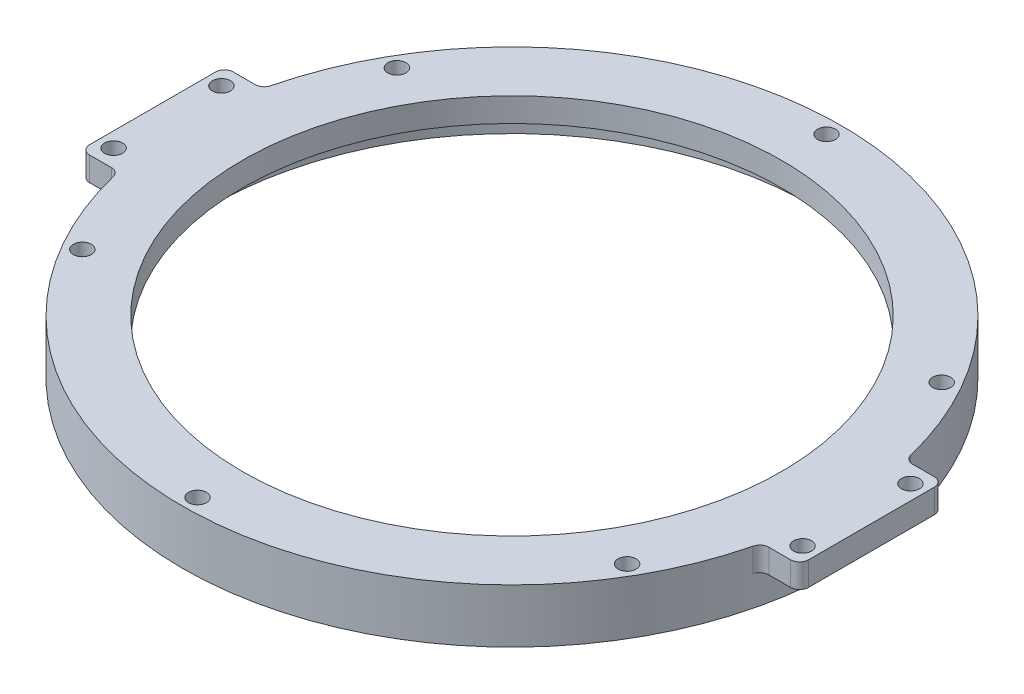
from build123d import *

# Parameters (mm, degrees)
SKETCH_1_R      = 1.5
SKETCH_1_R_2    = 45
EXTRUDE_1_DEPTH = 4
EXTRUDE_START   = -5
SKETCH_2_R      = 55
SKETCH_2_R_2    = 1.5
SKETCH_2_R_3    = 50
EXTRUDE_2_DEPTH = 5


with BuildPart() as part:
    # 草图1 → 凸台-拉伸1 (new body)
    with BuildSketch(Plane(origin=(0, 0, 0), x_dir=(1, 0, 0), z_dir=(0, 1, 0))):
        with BuildLine():
            ThreePointArc((-54.863466897, 12), (-53.938159008, 12.31940468), (-53.406914679, 13.14159292))
            ThreePointArc((-53.406914679, 13.14159292), (0, 55), (53.406914679, 13.14159292))
            ThreePointArc((53.406914679, 13.14159292), (53.938159008, 12.31940468), (54.863466897, 12))
            Line((54.863466897, 12), (58.5, 12))
            ThreePointArc((58.5, 12), (59.560660172, 11.560660172), (60, 10.5))
            Line((60, 10.5), (60, -10.5))
            ThreePointArc((60, -10.5), (59.560660172, -11.560660172), (58.5, -12))
            Line((58.5, -12), (54.863466897, -12))
            ThreePointArc((54.863466897, -12), (53.938159008, -12.31940468), (53.406914679, -13.14159292))
            ThreePointArc((53.406914679, -13.14159292), (0, -55), (-53.406914679, -13.14159292))
            ThreePointArc((-53.406914679, -13.14159292), (-53.938159008, -12.31940468), (-54.863466897, -12))
            Line((-54.863466897, -12), (-58.5, -12))
            ThreePointArc((-58.5, -12), (-59.560660172, -11.560660172), (-60, -10.5))
            Line((-60, -10.5), (-60, 10.5))
            ThreePointArc((-60, 10.5), (-59.560660172, 11.560660172), (-58.5, 12))
            Line((-58.5, 12), (-54.863466897, 12))
        make_face()
        with Locations(Location((-45.466333699, 26.25, 0), (0, 0, 270))):
            Circle(SKETCH_1_R, mode=Mode.SUBTRACT)
        with Locations(Location((-45.466333699, -26.25, 0), (0, 0, 270))):
            Circle(SKETCH_1_R, mode=Mode.SUBTRACT)
        with Locations(Location((0, -52.5, 0), (0, 0, 270))):
            Circle(SKETCH_1_R, mode=Mode.SUBTRACT)
        with Locations(Location((45.466333699, -26.25, 0), (0, 0, 270))):
            Circle(SKETCH_1_R, mode=Mode.SUBTRACT)
        with Locations(Location((45.466333699, 26.25, 0), (0, 0, 270))):
            Circle(SKETCH_1_R, mode=Mode.SUBTRACT)
        with Locations(Location((0, 52.5, 0), (0, 0, 270))):
            Circle(SKETCH_1_R, mode=Mode.SUBTRACT)
        with Locations(Location((57.5, 9, 0), (0, 0, 270))):
            Circle(SKETCH_1_R, mode=Mode.SUBTRACT)
        with Locations(Location((-57.5, -9, 0), (0, 0, 270))):
            Circle(SKETCH_1_R, mode=Mode.SUBTRACT)
        with Locations(Location((-57.5, 9, 0), (0, 0, 270))):
            Circle(SKETCH_1_R, mode=Mode.SUBTRACT)
        with Locations(Location((0, 0, 0), (0, 0, 270))):
            Circle(SKETCH_1_R_2, mode=Mode.SUBTRACT)
        with Locations(Location((57.5, -9, 0), (0, 0, 270))):
            Circle(SKETCH_1_R, mode=Mode.SUBTRACT)
    extrude(amount=EXTRUDE_1_DEPTH)

    # 草图2 → 凸台-拉伸2 (add)
    with BuildSketch(Plane(origin=(0, 0, 0), x_dir=(1, 0, 0), z_dir=(0, 1, 0)).offset(EXTRUDE_START)):
        with Locations(Location((0, 0, 0), (0, 0, 13.823871882))):
            Circle(SKETCH_2_R)
        with Locations(Location((-45.466333699, 26.25, 0), (0, 0, 270))):
            Circle(SKETCH_2_R_2, mode=Mode.SUBTRACT)
        with Locations(Location((-45.466333699, -26.25, 0), (0, 0, 270))):
            Circle(SKETCH_2_R_2, mode=Mode.SUBTRACT)
        with Locations(Location((0, -52.5, 0), (0, 0, 270))):
            Circle(SKETCH_2_R_2, mode=Mode.SUBTRACT)
        with Locations(Location((45.466333699, -26.25, 0), (0, 0, 270))):
            Circle(SKETCH_2_R_2, mode=Mode.SUBTRACT)
        with Locations(Location((45.466333699, 26.25, 0), (0, 0, 270))):
            Circle(SKETCH_2_R_2, mode=Mode.SUBTRACT)
        with Locations(Location((0, 52.5, 0), (0, 0, 270))):
            Circle(SKETCH_2_R_2, mode=Mode.SUBTRACT)
        with Locations(Location((0, 0, 0), (0, 0, 270))):
            Circle(SKETCH_2_R_3, mode=Mode.SUBTRACT)
    extrude(amount=EXTRUDE_2_DEPTH)


solid = part.part
